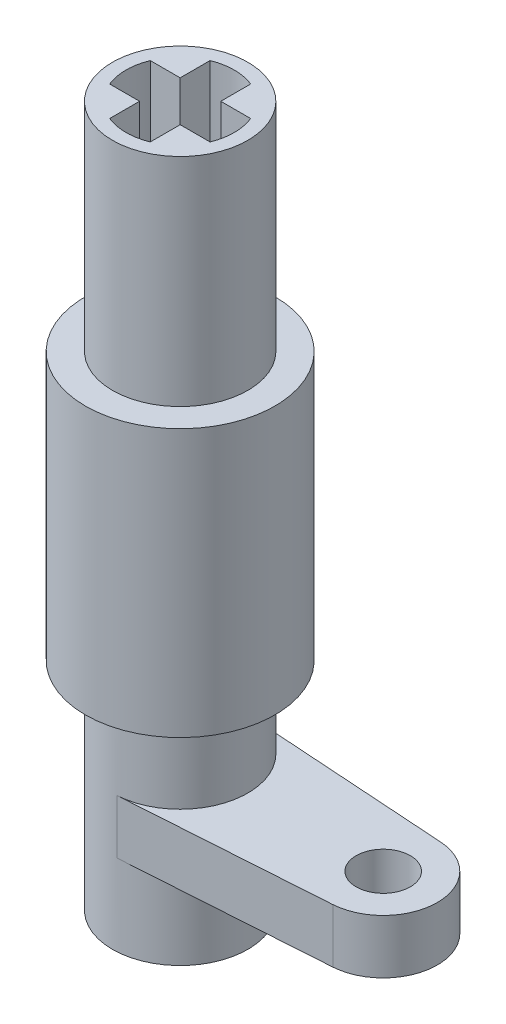
from build123d import *

# Parameters (mm, degrees)
SKETCH_1_R           = 2.5
EXTRUDE_1_DEPTH      = 25.88
EXTRUDE_START        = 3
SKETCH_2_R           = 1
EXTRUDE_2_DEPTH      = 2
CUT_EXTRUDE_1_DEPTH  = 4
CUT_EXTRUDE_START    = 21.88
CUT_EXTRUDE_2_DEPTH  = 4
SKETCH_6_R           = 0.25
CUT_EXTRUDE_3_DEPTH  = 0.25
CUT_EXTRUDE_START_2  = 4.25
SKETCH_7_R           = 0.25
CUT_EXTRUDE_4_DEPTH  = 0.25
EXTRUDE_START_2      = 8
SKETCH_17_R          = 3.5
EXTRUDE_5_DEPTH      = 9.88
SKETCH_18_R          = 1
CUT_EXTRUDE_11_DEPTH = 10
CUT_EXTRUDE_START_3  = 15.88
SKETCH_19_R          = 1
CUT_EXTRUDE_12_DEPTH = 10
SKETCH_22_W          = 4
SKETCH_22_H          = 2
CUT_EXTRUDE_13_DEPTH = 10
CUT_EXTRUDE_14_DEPTH = 2
CUT_EXTRUDE_START_4  = 12
CUT_EXTRUDE_15_DEPTH = 2
SKETCH_25_R          = 1
CUT_EXTRUDE_16_DEPTH = 28.789825476


with BuildPart() as part:
    # 草图1 → 凸台-拉伸1 (new body)
    with BuildSketch(Plane(origin=(0, 0, 0), x_dir=(1, 0, 0), z_dir=(0, 1, 0))):
        with Locations(Location((0, 0, 0), (0, 0, 270))):
            Circle(SKETCH_1_R)
    extrude(amount=EXTRUDE_1_DEPTH)

    # 草图2 → 凸台-拉伸2 (add)
    with BuildSketch(Plane(origin=(0, 0, 0), x_dir=(1, 0, 0), z_dir=(0, 1, 0)).offset(EXTRUDE_START)):
        with BuildLine():
            Line((0.166666667, 2.494438258), (7.633333333, 1.995550606))
            ThreePointArc((7.633333333, 1.995550606), (9.5, 0), (7.633333333, -1.995550606))
            Line((7.633333333, -1.995550606), (0.166666667, -2.494438258))
            ThreePointArc((0.166666667, -2.494438258), (-2.5, 0), (0.166666667, 2.494438258))
        make_face()
        with Locations(Location((7.5, 0, 0), (0, 0, 270))):
            Circle(SKETCH_2_R, mode=Mode.SUBTRACT)
    extrude(amount=EXTRUDE_2_DEPTH)

    # 草图3 → 切除-拉伸1 (cut)
    with BuildSketch(Plane(origin=(0, 0, 0), x_dir=(1, 0, 0), z_dir=(0, 1, 0))):
        with BuildLine():
            Line((-1.854049622, -0.75), (-0.75, -0.75))
            Line((-0.75, -0.75), (-0.75, -1.854049622))
            ThreePointArc((-0.75, -1.854049622), (0, -2), (0.75, -1.854049622))
            Line((0.75, -1.854049622), (0.75, -0.75))
            Line((0.75, -0.75), (1.854049622, -0.75))
            ThreePointArc((1.854049622, -0.75), (2, 0), (1.854049622, 0.75))
            Line((1.854049622, 0.75), (0.75, 0.75))
            Line((0.75, 0.75), (0.75, 1.854049622))
            ThreePointArc((0.75, 1.854049622), (0, 2), (-0.75, 1.854049622))
            Line((-0.75, 1.854049622), (-0.75, 0.75))
            Line((-0.75, 0.75), (-1.854049622, 0.75))
            ThreePointArc((-1.854049622, 0.75), (-2, 0), (-1.854049622, -0.75))
        make_face()
    extrude(amount=CUT_EXTRUDE_1_DEPTH, mode=Mode.SUBTRACT)

    # 草图5 → 切除-拉伸2 (cut)
    with BuildSketch(Plane(origin=(0, 0, 0), x_dir=(1, 0, 0), z_dir=(0, 1, 0)).offset(CUT_EXTRUDE_START)):
        with BuildLine():
            Line((1.854049622, 0.75), (0.75, 0.75))
            Line((0.75, 0.75), (0.75, 1.854049622))
            ThreePointArc((0.75, 1.854049622), (0, 2), (-0.75, 1.854049622))
            Line((-0.75, 1.854049622), (-0.75, 0.75))
            Line((-0.75, 0.75), (-1.854049622, 0.75))
            ThreePointArc((-1.854049622, 0.75), (-2, 0), (-1.854049622, -0.75))
            Line((-1.854049622, -0.75), (-0.75, -0.75))
            Line((-0.75, -0.75), (-0.75, -1.854049622))
            ThreePointArc((-0.75, -1.854049622), (0, -2), (0.75, -1.854049622))
            Line((0.75, -1.854049622), (0.75, -0.75))
            Line((0.75, -0.75), (1.854049622, -0.75))
            ThreePointArc((1.854049622, -0.75), (2, 0), (1.854049622, 0.75))
        make_face()
    extrude(amount=CUT_EXTRUDE_2_DEPTH, mode=Mode.SUBTRACT)

    # 草图6 → 切除-拉伸3 (cut)
    with BuildSketch(Plane(origin=(0, 0, 0), x_dir=(1, 0, 0), z_dir=(0, 1, 0)).offset(CUT_EXTRUDE_START)):
        with Locations(Location((0.75, 0, 0), (0, 0, 270))):
            Circle(SKETCH_6_R)
    extrude(amount=-CUT_EXTRUDE_3_DEPTH, mode=Mode.SUBTRACT)

    # 草图7 → 切除-拉伸4 (cut)
    with BuildSketch(Plane(origin=(0, 0, 0), x_dir=(1, 0, 0), z_dir=(0, 1, 0)).offset(CUT_EXTRUDE_START_2)):
        with Locations(Location((0.75, 0, 0), (0, 0, 270))):
            Circle(SKETCH_7_R)
    extrude(amount=-CUT_EXTRUDE_4_DEPTH, mode=Mode.SUBTRACT)

    # 草图17 → 凸台-拉伸5 (add)
    with BuildSketch(Plane(origin=(0, 0, 0), x_dir=(1, 0, 0), z_dir=(0, 1, 0)).offset(EXTRUDE_START_2)):
        with Locations(Location((0, 0, 0), (0, 0, 270))):
            Circle(SKETCH_17_R)
    extrude(amount=EXTRUDE_5_DEPTH)

    # 草图18 → 切除-拉伸11 (cut)
    with BuildSketch(Plane(origin=(0, 0, 0), x_dir=(1, 0, 0), z_dir=(0, 1, 0))):
        with Locations(Location((0, 0, 0), (0, 0, 270))):
            Circle(SKETCH_18_R)
    extrude(amount=CUT_EXTRUDE_11_DEPTH, mode=Mode.SUBTRACT)

    # 草图19 → 切除-拉伸12 (cut)
    with BuildSketch(Plane(origin=(0, 0, 0), x_dir=(1, 0, 0), z_dir=(0, 1, 0)).offset(CUT_EXTRUDE_START_3)):
        with Locations(Location((0, 0, 0), (0, 0, 270))):
            Circle(SKETCH_19_R)
    extrude(amount=CUT_EXTRUDE_12_DEPTH, mode=Mode.SUBTRACT)

    # 草图22 → 切除-拉伸13 (cut)
    with BuildSketch(Plane(origin=(0, 0, 0), x_dir=(0, 0, -1), z_dir=(1, 0, 0))):
        with Locations((0, 14.88)):
            Rectangle(SKETCH_22_W, SKETCH_22_H)
        with Locations((0, 11)):
            Rectangle(SKETCH_22_W, SKETCH_22_H)
    extrude(amount=-CUT_EXTRUDE_13_DEPTH, mode=Mode.SUBTRACT)

    # 草图23 → 切除-拉伸14 (cut)
    with BuildSketch(Plane(origin=(0, 0, 0), x_dir=(1, 0, 0), z_dir=(0, 1, 0)).offset(CUT_EXTRUDE_START_3)):
        Polygon((-2.309401077, 0), (-1.154700538, -2), (1.154700538, -2), (2.309401077, 0), (1.154700538, 2), (-1.154700538, 2), align=None)
    extrude(amount=-CUT_EXTRUDE_14_DEPTH, mode=Mode.SUBTRACT)

    # 草图24 → 切除-拉伸15 (cut)
    with BuildSketch(Plane(origin=(0, 0, 0), x_dir=(1, 0, 0), z_dir=(0, 1, 0)).offset(CUT_EXTRUDE_START_4)):
        Polygon((-2.309401077, 0), (-1.154700538, -2), (1.154700538, -2), (2.309401077, 0), (1.154700538, 2), (-1.154700538, 2), align=None)
    extrude(amount=-CUT_EXTRUDE_15_DEPTH, mode=Mode.SUBTRACT)

    # 草图25 → 切除-拉伸16 (cut, through all)
    with BuildSketch(Plane(origin=(0, 0, 0), x_dir=(1, 0, 0), z_dir=(0, 1, 0))):
        with Locations(Location((0, 0, 0), (0, 0, 270))):
            Circle(SKETCH_25_R)
    extrude(amount=CUT_EXTRUDE_16_DEPTH, mode=Mode.SUBTRACT)


solid = part.part
